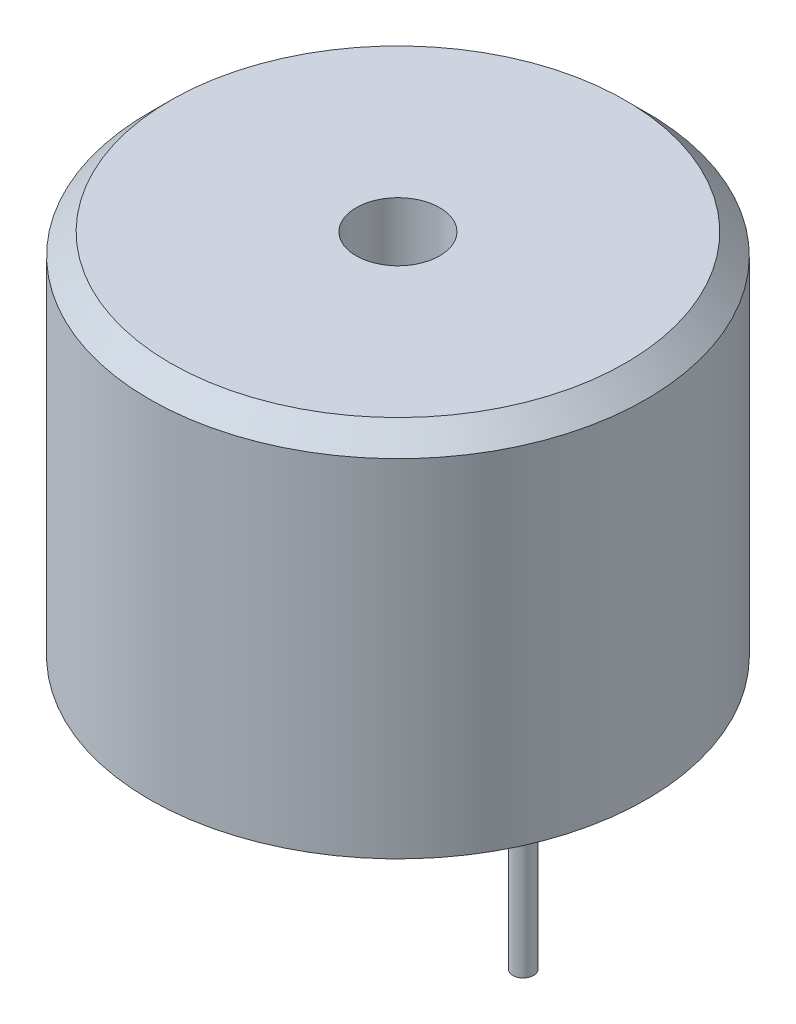
from build123d import *

# Parameters (mm, degrees)
SKETCH1_R           = 5.95
BOSS_EXTRUDE1_DEPTH = 8.8
SKETCH2_R           = 1
CUT_EXTRUDE1_DEPTH  = 2
CHAMFER1_SIZE       = 0.5
SKETCH3_R           = 0.25
BOSS_EXTRUDE2_DEPTH = 5


with BuildPart() as part:
    # Sketch1 → Boss-Extrude1 (new body)
    with BuildSketch(Plane(origin=(0, 0, 0), x_dir=(1, 0, 0), z_dir=(0, 1, 0))):
        with Locations(Location((0, 0, 0), (0, 0, 270))):
            Circle(SKETCH1_R)
    extrude(amount=BOSS_EXTRUDE1_DEPTH)

    # Sketch2 → Cut-Extrude1 (cut)
    with BuildSketch(Plane(origin=(0, 8.8, 0), x_dir=(1, 0, 0), z_dir=(0, 1, 0))):
        with Locations(Location((0, 0, 0), (0, 0, 270))):
            Circle(SKETCH2_R)
    extrude(amount=-CUT_EXTRUDE1_DEPTH, mode=Mode.SUBTRACT)

    # Chamfer1
    chamfer1_edges = [part.edges().sort_by_distance(p)[0] for p in [
        (0, 8.8, -5.95),
    ]]
    chamfer(chamfer1_edges, length=CHAMFER1_SIZE)

    # Sketch3 → Boss-Extrude2 (add)
    with BuildSketch(Plane.XZ):
        with Locations(Location((-3, 0, 0), (0, 0, 90))):
            Circle(SKETCH3_R)
    boss_extrude2 = extrude(amount=BOSS_EXTRUDE2_DEPTH)

    # Mirror1: Boss-Extrude2 across plane
    add(boss_extrude2.mirror(Plane(origin=(0, 0, 0), x_dir=(0, 0, 1), z_dir=(1, 0, 0))))


solid = part.part
